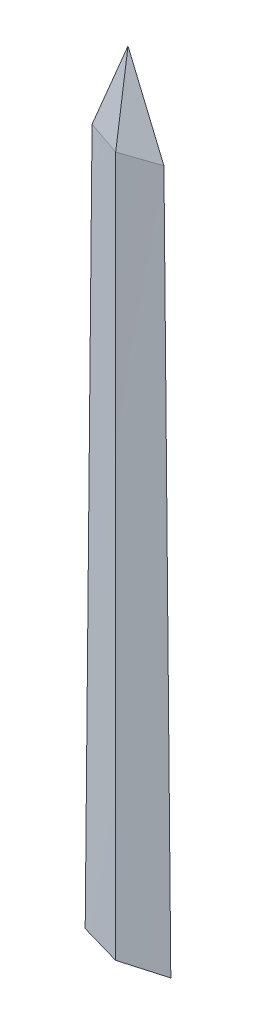
from build123d import *

# Parameters (mm, degrees)
BOSS_EXTRUDE1_DEPTH      = 11.1125
BOSS_EXTRUDE1_DEPTH_BACK = 11.1125
SKETCH5_W                = 109.877468776
SKETCH5_H                = 283.051122129
CUT_EXTRUDE2_DEPTH       = 1193.492852366
SKETCH6_W                = 149.121482991
SKETCH6_H                = 108.921761737
CUT_EXTRUDE3_DEPTH       = 1175.662940665
SKETCH7_R                = 4.7625
CUT_EXTRUDE4_DEPTH       = 635


with BuildPart() as part:
    # Sketch1 → Boss-Extrude1 (new, two sides: drawn at the far end of the back side and taken through both)
    with BuildSketch(Plane.XY.offset(-BOSS_EXTRUDE1_DEPTH_BACK)):
        Polygon((142.42123069, 465.168027231), (219.716026672, 465.168027231), (213.502471629, 1096.967634552), (181.068628681, 1174.337215652), (148.634785732, 1096.967634552), align=None)
    extrude(amount=BOSS_EXTRUDE1_DEPTH + BOSS_EXTRUDE1_DEPTH_BACK)

    # Sketch2 → Cut-Loft1 section 0
    with BuildSketch(Plane.XZ.offset(-465.168027231)):
        with BuildLine():
            Line((142.42123069, 0), (181.068628681, 11.1125))
            Line((181.068628681, 11.1125), (219.716026672, 0))
            Line((219.716026672, 0), (222.70513775, 0))
            Line((222.70513775, 0), (222.70513775, 15.258366339))
            Line((222.70513775, 15.258366339), (137.848628215, 15.258366339))
            Line((137.848628215, 15.258366339), (137.848628215, 0))
            Line((137.848628215, 0), (142.42123069, 0))
        make_face()
    # Sketch3 → Cut-Loft1 section 1
    with BuildSketch(Plane(origin=(0, 1096.967634552, 0), x_dir=(1, 0, 0), z_dir=(0, 1, 0))):
        with BuildLine():
            Line((213.502471629, 0), (181.068628681, -11.1125))
            Line((181.068628681, -11.1125), (148.634785732, 0))
            Line((148.634785732, 0), (137.848628215, 0))
            Line((137.848628215, 0), (137.848628215, -15.258366339))
            Line((137.848628215, -15.258366339), (222.70513775, -15.258366339))
            Line((222.70513775, -15.258366339), (222.70513775, 0))
            Line((222.70513775, 0), (213.502471629, 0))
        make_face()
    cut_loft1 = loft(mode=Mode.SUBTRACT)

    # Mirror1: Cut-Loft1 across plane
    add(cut_loft1.mirror(Plane.XY), mode=Mode.SUBTRACT)

    # Sketch5 → Cut-Extrude2 (cut, through all)
    with BuildSketch(Plane(origin=(-32.103098407, 13.457832356, 93.698704331), x_dir=(0.9470206004067627, 0.045661094409327196, 0.31791043842968925), z_dir=(-0.3211728232668741, 0.1346377834927197, 0.937401026696127))):
        with Locations((219.349244299, 1139.303724701)):
            Rectangle(SKETCH5_W, SKETCH5_H)
    cut_extrude2 = extrude(amount=CUT_EXTRUDE2_DEPTH, mode=Mode.SUBTRACT)

    # Sketch6 → Cut-Extrude3 (cut, through all)
    with BuildSketch(Plane(origin=(69.458274406, 29.117370568, 202.726547902), x_dir=(0.9470206004067623, -0.045661094409327495, -0.31791043842969063), z_dir=(0.3211728232668754, 0.13463778349272, 0.9374010266961263))):
        with Locations((131.752816965, 1118.922251835)):
            Rectangle(SKETCH6_W, SKETCH6_H)
    cut_extrude3 = extrude(amount=CUT_EXTRUDE3_DEPTH, mode=Mode.SUBTRACT)

    # Mirror2: Cut-Extrude2, Cut-Extrude3 across plane
    add(cut_extrude2.mirror(Plane.XY), mode=Mode.SUBTRACT)
    add(cut_extrude3.mirror(Plane.XY), mode=Mode.SUBTRACT)

    # Sketch7 → Cut-Extrude4 (cut)
    with BuildSketch(Plane.XZ.offset(-465.168027231)):
        with Locations(Location((181.068628681, 0, 0), (0, 0, 270))):
            Circle(SKETCH7_R)
    extrude(amount=-CUT_EXTRUDE4_DEPTH, mode=Mode.SUBTRACT)


solid = part.part
